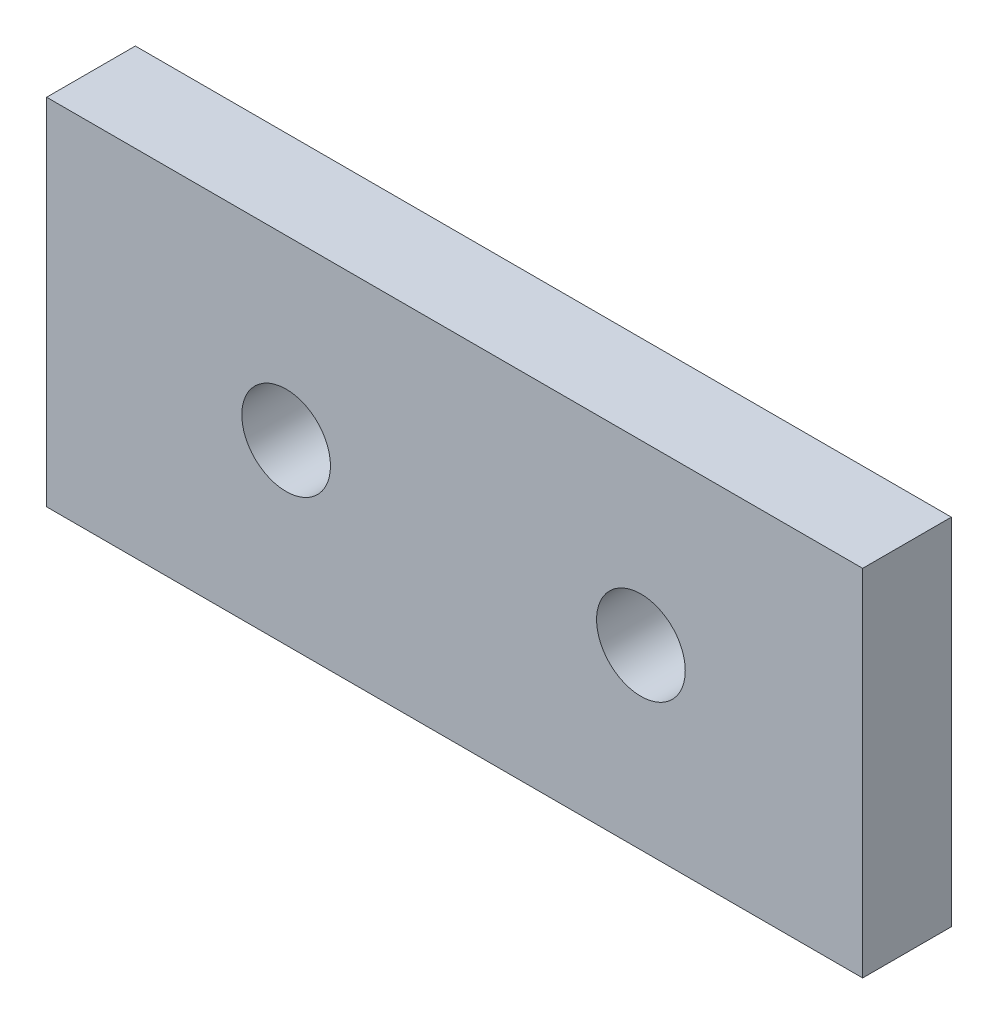
from build123d import *

# Parameters (mm, degrees)
SZKIC1_W                    = 92
SZKIC1_H                    = 40
SZKIC1_R                    = 5
DODANIE_WYCI_GNI_CIE1_DEPTH = 10


with BuildPart() as part:
    # Szkic1 → Dodanie-wyciągnięcie1 (new body)
    with BuildSketch(Plane.XY):
        Rectangle(SZKIC1_W, SZKIC1_H)
        with Locations((21, 0)):
            Circle(SZKIC1_R, mode=Mode.SUBTRACT)
        with Locations((-19, 0)):
            Circle(SZKIC1_R, mode=Mode.SUBTRACT)
    extrude(amount=DODANIE_WYCI_GNI_CIE1_DEPTH)


solid = part.part
